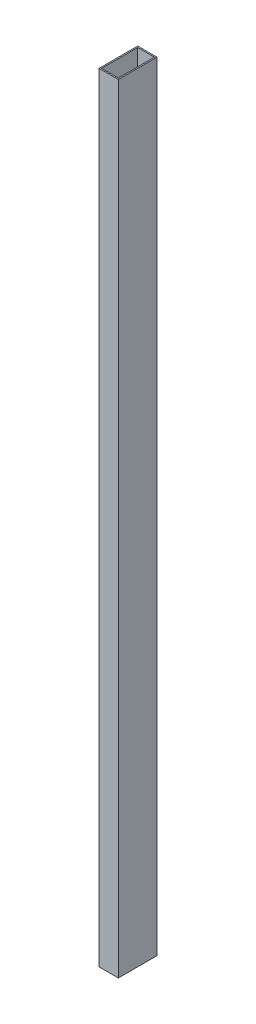
from build123d import *

# Parameters (mm, degrees)
SKETCH1_W           = 25.4
SKETCH1_H           = 50.8
SKETCH1_W_2         = 22.098
SKETCH1_H_2         = 47.498
BOSS_EXTRUDE1_DEPTH = 1022.35


with BuildPart() as part:
    # Sketch1 → Boss-Extrude1 (new body)
    with BuildSketch(Plane(origin=(0, 0, 0), x_dir=(1, 0, 0), z_dir=(0, 1, 0))):
        with Locations((-46.093006993, -17.170696162)):
            Rectangle(SKETCH1_W, SKETCH1_H)
        with Locations((-46.093006993, -17.170696162)):
            Rectangle(SKETCH1_W_2, SKETCH1_H_2, mode=Mode.SUBTRACT)
    extrude(amount=BOSS_EXTRUDE1_DEPTH)


solid = part.part
